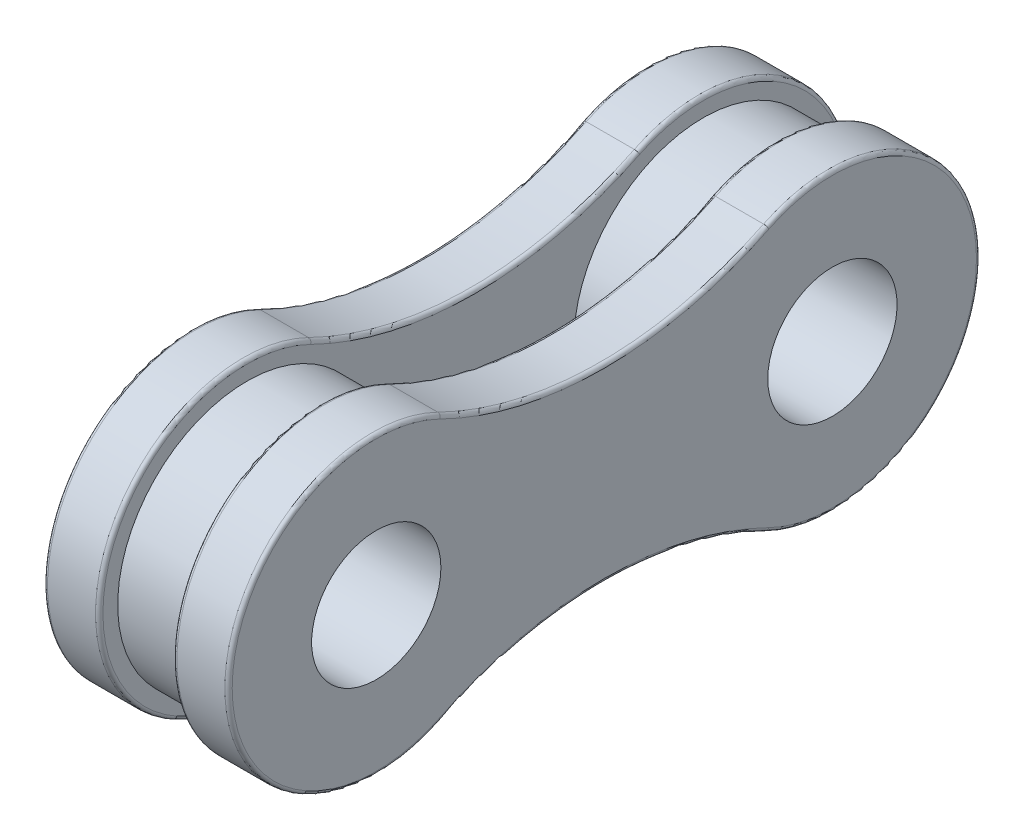
from build123d import *

# Parameters (mm, degrees)
BOSS_EXTRUDE1_START = 1
SKETCH1_R           = 1.75
BOSS_EXTRUDE1_DEPTH = 1.5
BOSS_EXTRUDE2_START = -1
SKETCH2_R           = 1.75
BOSS_EXTRUDE2_DEPTH = 1.5
SKETCH3_R           = 3.5
SKETCH3_R_2         = 1.75
BOSS_EXTRUDE3_DEPTH = 1
FILLET1_R           = 0.1


with BuildPart() as part:
    # Sketch1 → Boss-Extrude1 (new body)
    with BuildSketch(Plane(origin=(0, 0, 0), x_dir=(0, 0, -1), z_dir=(1, 0, 0)).offset(BOSS_EXTRUDE1_START)):
        with BuildLine():
            ThreePointArc((-4.410714286, 3.589888009), (-10.175, 0), (-4.410714286, -3.589888009))
            ThreePointArc((-4.410714286, -3.589888009), (0, -2.564608032), (4.410714286, -3.589888009))
            ThreePointArc((4.410714286, -3.589888009), (10.175, 0), (4.410714286, 3.589888009))
            ThreePointArc((4.410714286, 3.589888009), (0, 2.564608032), (-4.410714286, 3.589888009))
        make_face()
        with Locations((-6.175, 0)):
            Circle(SKETCH1_R, mode=Mode.SUBTRACT)
        with Locations(Location((6.175, 0, 0), (0, 0, 180))):
            Circle(SKETCH1_R, mode=Mode.SUBTRACT)
    extrude(amount=BOSS_EXTRUDE1_DEPTH)



with BuildPart() as body_2:
    # Sketch2 → Boss-Extrude2 (new body)
    with BuildSketch(Plane(origin=(0, 0, 0), x_dir=(0, 0, -1), z_dir=(1, 0, 0)).offset(BOSS_EXTRUDE2_START)):
        with BuildLine():
            ThreePointArc((-4.410714286, 3.589888009), (0, 2.564608032), (4.410714286, 3.589888009))
            ThreePointArc((4.410714286, 3.589888009), (10.175, 0), (4.410714286, -3.589888009))
            ThreePointArc((4.410714286, -3.589888009), (0, -2.564608032), (-4.410714286, -3.589888009))
            ThreePointArc((-4.410714286, -3.589888009), (-10.175, 0), (-4.410714286, 3.589888009))
        make_face()
        with Locations(Location((6.175, 0, 0), (0, 0, 180))):
            Circle(SKETCH2_R, mode=Mode.SUBTRACT)
        with Locations((-6.175, 0)):
            Circle(SKETCH2_R, mode=Mode.SUBTRACT)
    extrude(amount=-BOSS_EXTRUDE2_DEPTH)


with BuildPart() as part_1:
    add(part.part)

    add(body_2.part)  # Boss-Extrude3 merges body 2
    # Sketch3 → Boss-Extrude3 (add, symmetric)
    # profile 1 of 2: a face of its own
    with BuildSketch(Plane(origin=(0, 0, 0), x_dir=(0, 0, -1), z_dir=(1, 0, 0))):
        with Locations((-6.175, 0)):
            Circle(SKETCH3_R)
        with Locations((-6.175, 0)):
            Circle(SKETCH3_R_2, mode=Mode.SUBTRACT)
    # profile 2 of 2: a face of its own
    with BuildSketch(Plane(origin=(0, 0, 0), x_dir=(0, 0, -1), z_dir=(1, 0, 0))):
        with Locations((6.175, 0)):
            Circle(SKETCH3_R)
        with Locations(Location((6.175, 0, 0), (0, 0, 180))):
            Circle(SKETCH3_R_2, mode=Mode.SUBTRACT)
    extrude(amount=BOSS_EXTRUDE3_DEPTH, both=True)

    # Fillet1
    fillet1_edges = [part_1.edges().sort_by_distance(p)[0] for p in [
        (2.5, -2.564608032, 0),
        (2.5, 0, -10.175),
        (-2.5, 0, 10.175),
        (-2.5, 2.564608032, 0),
        (-2.5, 0, -10.175),
        (-2.5, -2.564608032, 0),
        (-1, 0, 10.175),
        (-1, -2.564608032, 0),
        (-1, 0, -10.175),
        (-1, 2.564608032, 0),
        (2.5, 2.564608032, 0),
        (1, 0, -10.175),
        (1, -2.564608032, 0),
        (1, 0, 10.175),
        (1, 2.564608032, 0),
        (2.5, 0, 10.175),
    ]]
    fillet(fillet1_edges, radius=FILLET1_R)


solid = part_1.part
